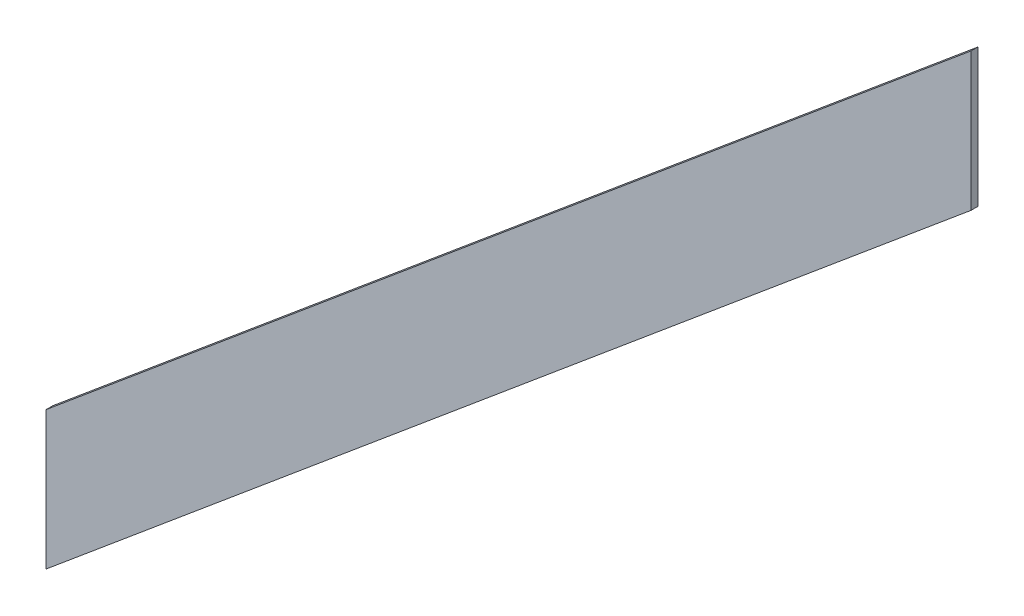
from build123d import *

# Parameters (mm, degrees)
BOSS_EXTRUDE2_DEPTH = 5


with BuildPart() as part:
    # Sketch1 → Boss-Extrude2 (new body)
    with BuildSketch(Plane.XY):
        Polygon((-310.633143495, -166.84129799), (-310.633143495, -266.84129799), (359.366856505, 293.15870201), (359.366856505, 393.15870201), align=None)
    extrude(amount=BOSS_EXTRUDE2_DEPTH)


solid = part.part
